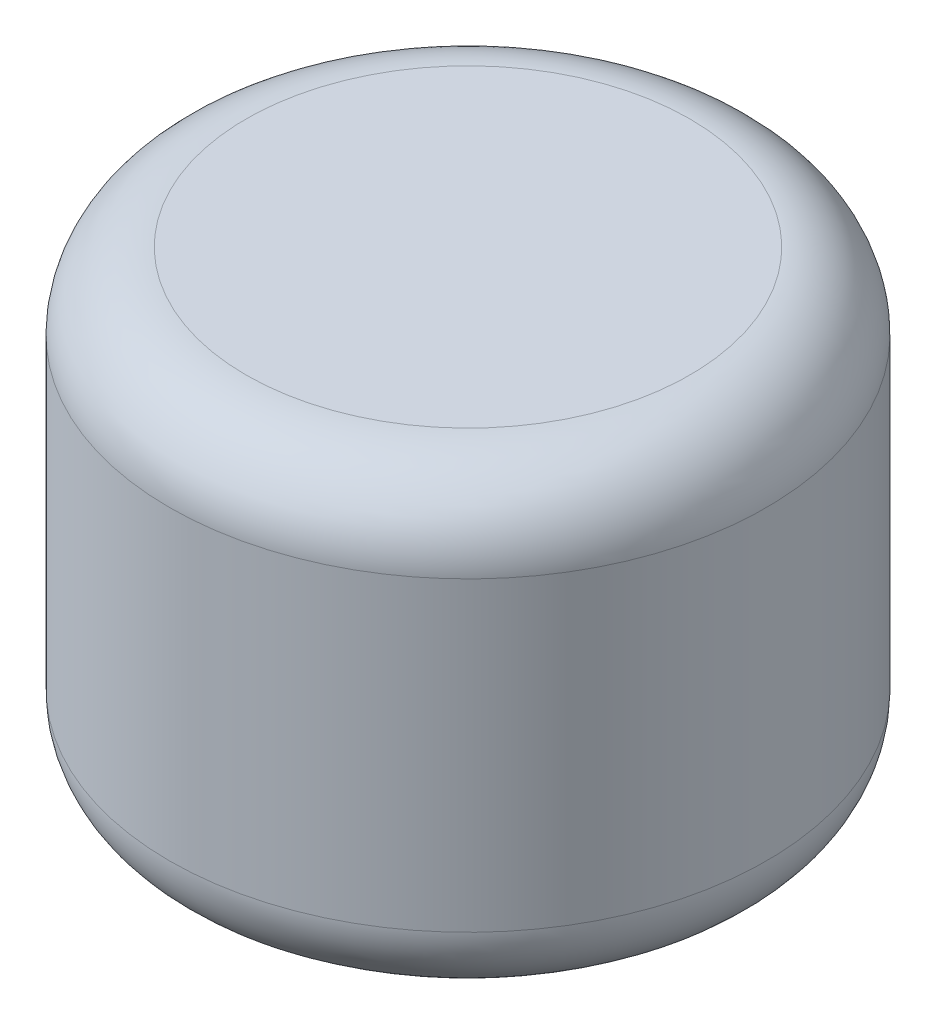
from build123d import *

# Parameters (mm, degrees)
SKETCH1_R           = 49.53
BOSS_EXTRUDE1_DEPTH = 76.2
FILLET1_R           = 12.7


with BuildPart() as part:
    # Sketch1 → Boss-Extrude1 (new body)
    with BuildSketch(Plane(origin=(0, 0, 0), x_dir=(1, 0, 0), z_dir=(0, 1, 0))):
        with Locations(Location((0, 0, 0), (0, 0, 90))):
            Circle(SKETCH1_R)
    extrude(amount=BOSS_EXTRUDE1_DEPTH)

    # Fillet1
    fillet1_edges = [part.edges().sort_by_distance(p)[0] for p in [
        (0, 0, 49.53),
        (0, 76.2, 49.53),
    ]]
    fillet(fillet1_edges, radius=FILLET1_R)


solid = part.part
